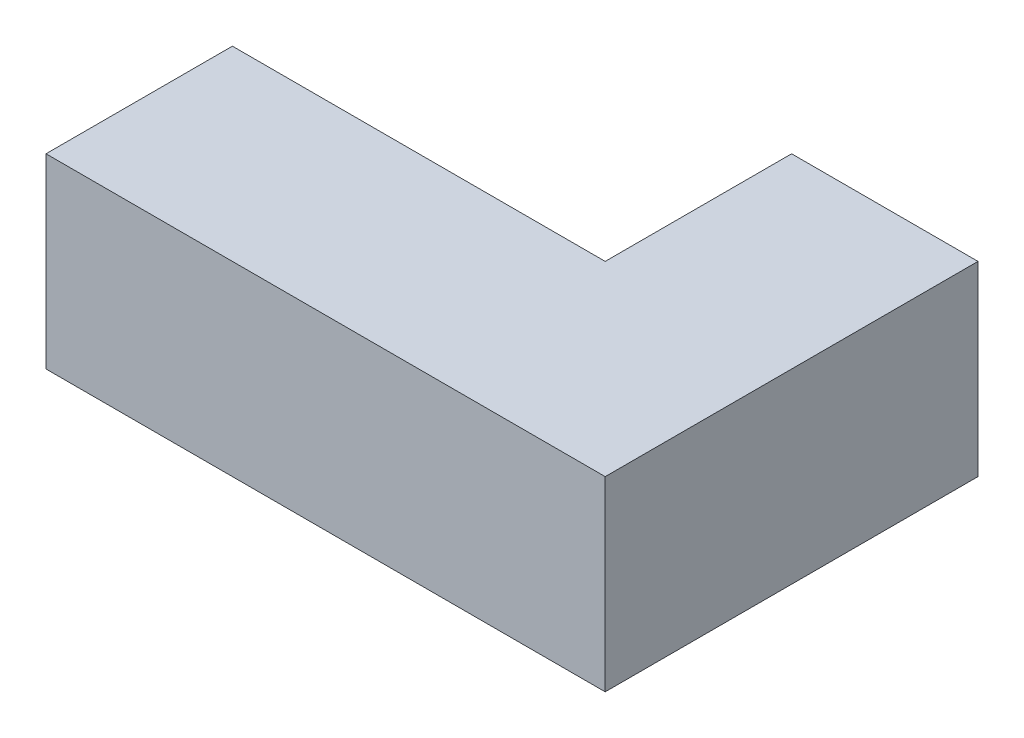
from build123d import *

# Parameters (mm, degrees)
BOSS_EXTRUDE1_DEPTH = 30


with BuildPart() as part:
    # Sketch1 → Boss-Extrude1 (new body)
    with BuildSketch(Plane(origin=(0, 0, 0), x_dir=(1, 0, 0), z_dir=(0, 1, 0))):
        Polygon((0, 0), (90, 0), (90, 60), (60, 60), (60, 30), (0, 30), align=None)
    extrude(amount=BOSS_EXTRUDE1_DEPTH)


solid = part.part
